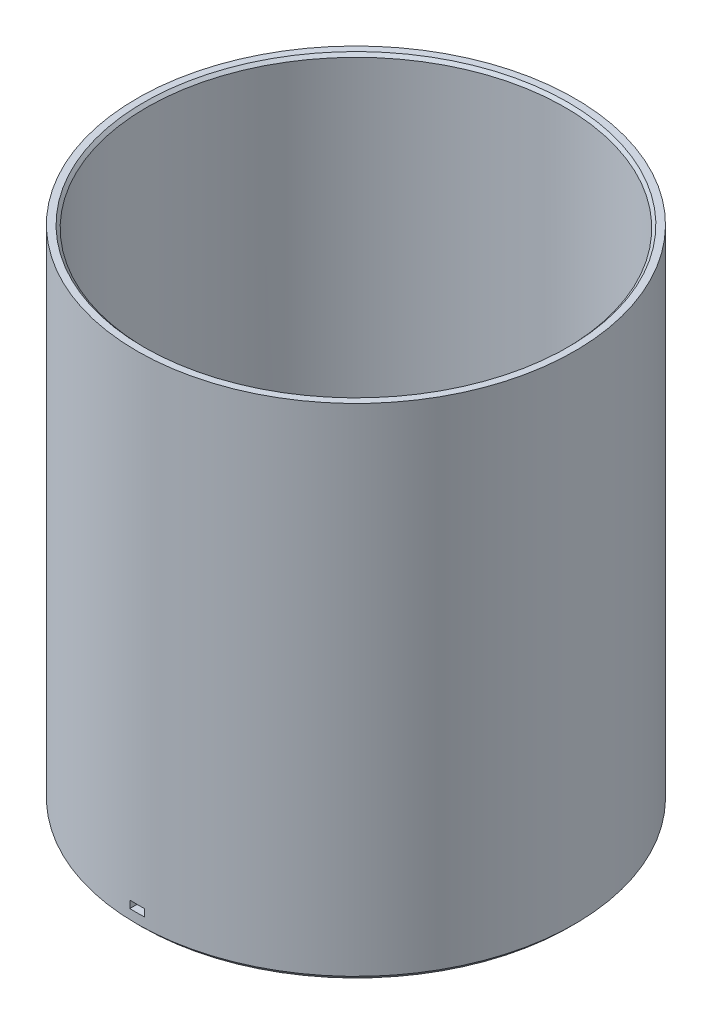
from build123d import *

# Parameters (mm, degrees)
SKETCH1_R           = 45
BOSS_EXTRUDE1_DEPTH = 3
SKETCH2_R           = 45
SKETCH2_R_2         = 43
BOSS_EXTRUDE2_DEPTH = 100
BOSS_EXTRUDE3_DEPTH = 5
SKETCH4_W           = 3
SKETCH4_H           = 1.5
CUT_EXTRUDE1_DEPTH  = 5
CHAMFER1_SIZE       = 0.6
CHAMFER2_SIZE       = 1


with BuildPart() as part:
    # Sketch1 → Boss-Extrude1 (new body)
    with BuildSketch(Plane(origin=(0, 0, 0), x_dir=(1, 0, 0), z_dir=(0, 1, 0))):
        with Locations(Location((0, 0, 0), (0, 0, 270))):
            Circle(SKETCH1_R)
    extrude(amount=BOSS_EXTRUDE1_DEPTH)

    # Sketch2 → Boss-Extrude2 (add)
    with BuildSketch(Plane(origin=(0, 3, 0), x_dir=(1, 0, 0), z_dir=(0, 1, 0))):
        with Locations(Location((0, 0, 0), (0, 0, 270))):
            Circle(SKETCH2_R)
        with Locations(Location((0, 0, 0), (0, 0, 270))):
            Circle(SKETCH2_R_2, mode=Mode.SUBTRACT)
    extrude(amount=BOSS_EXTRUDE2_DEPTH)

    # Sketch3 → Boss-Extrude3 (add)
    with BuildSketch(Plane(origin=(0, 3, 0), x_dir=(1, 0, 0), z_dir=(0, 1, 0))):
        with BuildLine():
            Line((-1.5, -15.176050211), (-1.5, -17.184658856))
            ThreePointArc((-1.5, -17.184658856), (0, 17.25), (1.5, -17.184658856))
            Line((1.5, -17.184658856), (1.5, -15.176050211))
            ThreePointArc((1.5, -15.176050211), (0, 15.25), (-1.5, -15.176050211))
        make_face()
    extrude(amount=BOSS_EXTRUDE3_DEPTH)

    # Sketch4 → Cut-Extrude1 (cut)
    with BuildSketch(Plane.XY.offset(45)):
        with Locations((0, 3.75)):
            Rectangle(SKETCH4_W, SKETCH4_H)
    extrude(amount=-CUT_EXTRUDE1_DEPTH, mode=Mode.SUBTRACT)

    # Chamfer1
    chamfer1_edges = [part.edges().sort_by_distance(p)[0] for p in [
        (0, 103, -43),
    ]]
    chamfer(chamfer1_edges, length=CHAMFER1_SIZE)

    # Chamfer2
    chamfer2_edges = [part.edges().sort_by_distance(p)[0] for p in [
        (0, 0, -45),
    ]]
    chamfer(chamfer2_edges, length=CHAMFER2_SIZE)


solid = part.part
